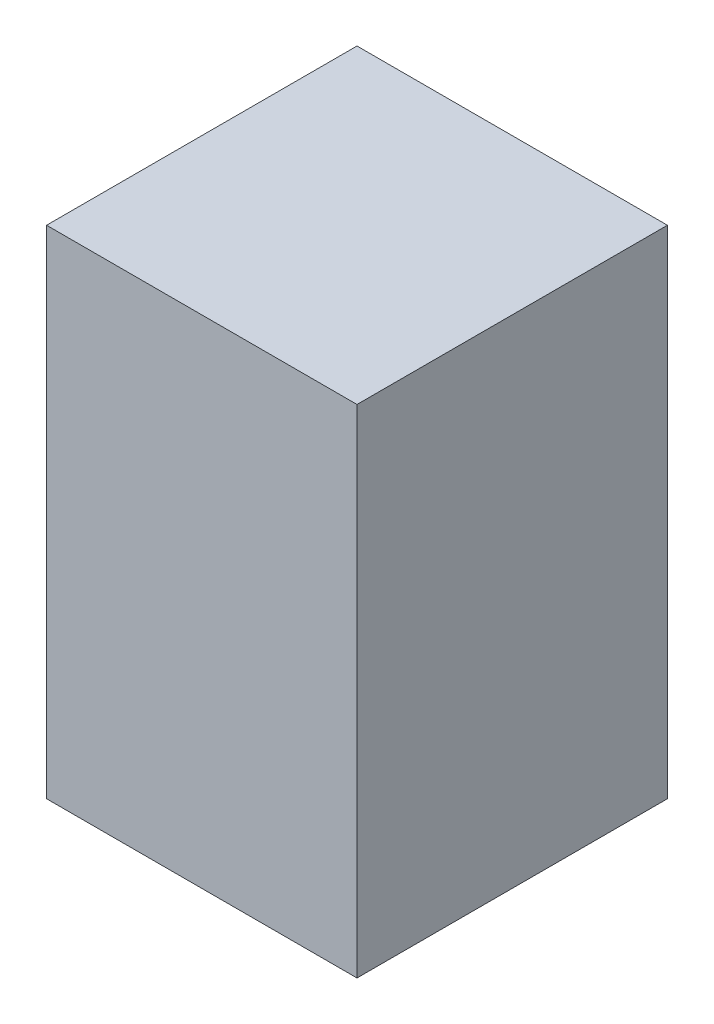
from build123d import *

# Parameters (mm, degrees)
SKETCH1_W           = 381
SKETCH1_H           = 381
BOSS_EXTRUDE1_DEPTH = 609.6


with BuildPart() as part:
    # Sketch1 → Boss-Extrude1 (new body)
    with BuildSketch(Plane(origin=(0, 0, 0), x_dir=(1, 0, 0), z_dir=(0, 1, 0))):
        with Locations((-4.535714286, -13.607142857)):
            Rectangle(SKETCH1_W, SKETCH1_H)
    extrude(amount=BOSS_EXTRUDE1_DEPTH)


solid = part.part
